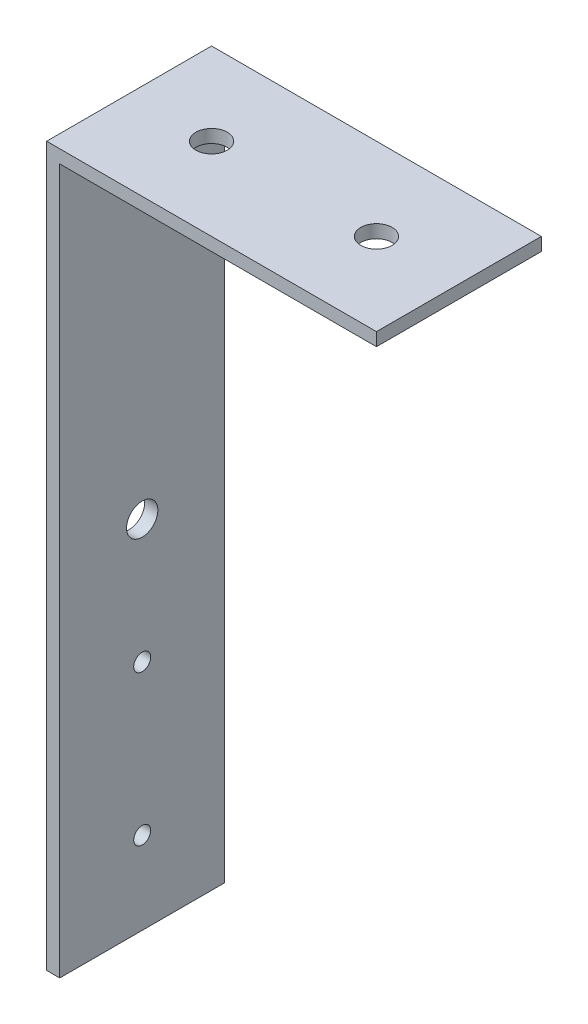
from build123d import *

# Parameters (mm, degrees)
BOSS_EXTRUDE1_DEPTH   = 20
F_6_CLEARANCE_HOLE1_D = 3.7973
F_1_CLEARANCE_HOLE2_D = 2.0574
F_6_CLEARANCE_HOLE2_D = 3.7973


with BuildPart() as part:
    # Sketch2 → Boss-Extrude1 (new body)
    with BuildSketch(Plane.XY):
        Polygon((0, 0), (0, 87.1), (40, 87.1), (40, 85.5125), (1.5875, 85.5125), (1.5875, 0), align=None)
    extrude(amount=BOSS_EXTRUDE1_DEPTH)

    # #6 Clearance Hole1 (through all)
    with Locations(Plane(origin=(0, 87.1, 0), x_dir=(1, 0, 0), z_dir=(0, 1, 0))):
        with Locations((10, -10), (30, -10)):
            Hole(F_6_CLEARANCE_HOLE1_D / 2)

    # #1 Clearance Hole2 (through all)
    with Locations(Plane.ZY):
        with Locations((10, 10), (10, 28.2)):
            Hole(F_1_CLEARANCE_HOLE2_D / 2)

    # #6 Clearance Hole2 (through all)
    with Locations(Plane.ZY):
        with Locations((10, 43.2)):
            Hole(F_6_CLEARANCE_HOLE2_D / 2)


solid = part.part
